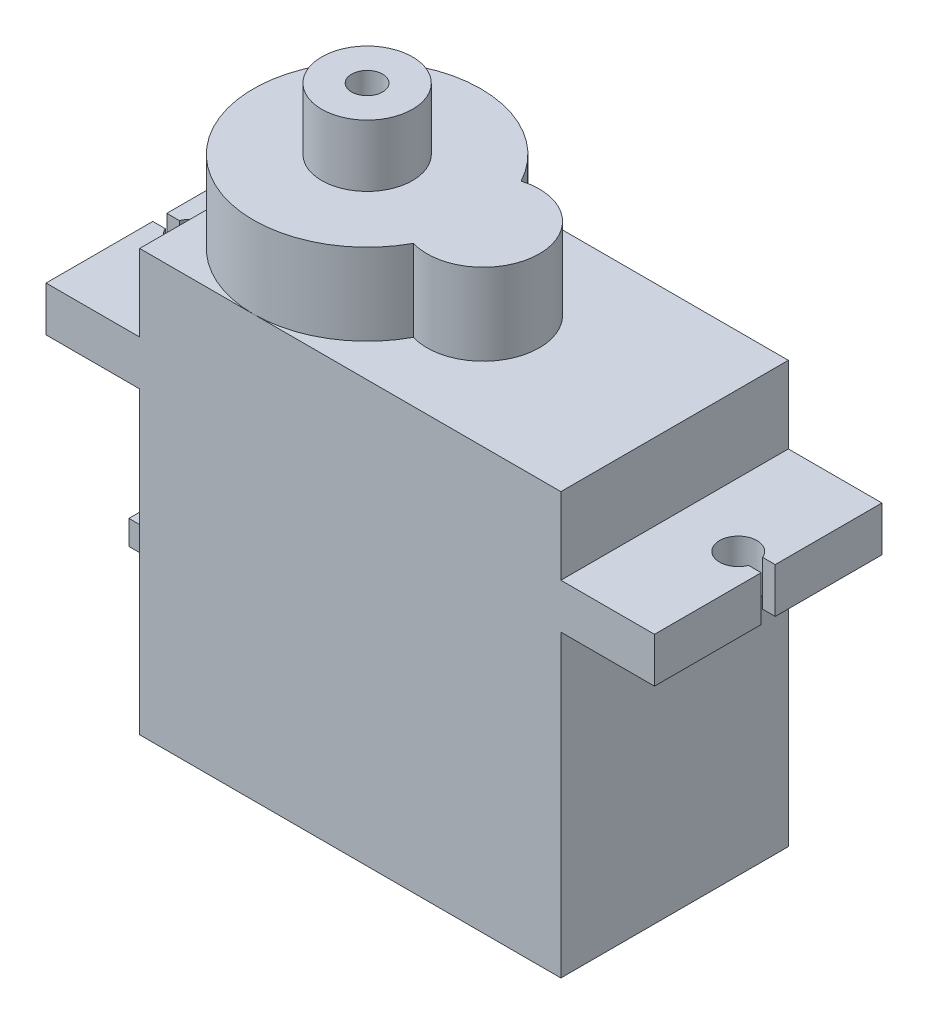
from build123d import *

# Parameters (mm, degrees)
BOSS_EXTRUDE1_DEPTH = 12.15
BOSS_EXTRUDE2_DEPTH = 4.35
SKETCH5_R           = 2.425
BOSS_EXTRUDE3_DEPTH = 3.3
SKETCH6_R           = 0.828221189
CUT_EXTRUDE3_DEPTH  = 4
SKETCH8_R           = 1
CUT_EXTRUDE4_DEPTH  = 5
SKETCH9_W           = 2.165756054
SKETCH9_H           = 0.75
SKETCH9_W_2         = 1.729877666
CUT_EXTRUDE5_DEPTH  = 5
SKETCH10_W          = 3.3
SKETCH10_H          = 1.3
BOSS_EXTRUDE6_DEPTH = 27.5


with BuildPart() as part:
    # Sketch1 → Boss-Extrude1 (new body)
    with BuildSketch(Plane.XY):
        Polygon((-11.25, -11.25), (11.25, -11.25), (11.25, 4.75), (16.25, 4.75), (16.25, 7.15), (11.25, 7.15), (11.25, 11.25), (-11.25, 11.25), (-11.25, 7.15), (-16.25, 7.15), (-16.25, 4.75), (-11.25, 4.75), align=None)
    extrude(amount=BOSS_EXTRUDE1_DEPTH)

    # Sketch4 → Boss-Extrude2 (add)
    with BuildSketch(Plane(origin=(0, 11.25, 0), x_dir=(1, 0, 0), z_dir=(0, 1, 0))):
        with BuildLine():
            ThreePointArc((0.175453629, -3.197801543), (-11.25, -6.075), (0.175453629, -8.952198457))
            ThreePointArc((0.175453629, -8.952198457), (4.025, -6.075), (0.175453629, -3.197801543))
        make_face()
    extrude(amount=BOSS_EXTRUDE2_DEPTH)

    # Sketch5 → Boss-Extrude3 (add)
    with BuildSketch(Plane(origin=(0, 15.6, 0), x_dir=(1, 0, 0), z_dir=(0, 1, 0))):
        with Locations(Location((-5.175, -6.075, 0), (0, 0, 270))):
            Circle(SKETCH5_R)
    extrude(amount=BOSS_EXTRUDE3_DEPTH)

    # Sketch6 → Cut-Extrude3 (cut)
    with BuildSketch(Plane(origin=(0, 18.9, 0), x_dir=(1, 0, 0), z_dir=(0, 1, 0))):
        with Locations(Location((-5.175, -6.075, 0), (0, 0, 270))):
            Circle(SKETCH6_R)
    extrude(amount=-CUT_EXTRUDE3_DEPTH, mode=Mode.SUBTRACT)

    # Sketch8 → Cut-Extrude4 (cut)
    with BuildSketch(Plane(origin=(0, 7.15, 0), x_dir=(1, 0, 0), z_dir=(0, 1, 0))):
        with Locations(Location((-14.65, -6.075, 0), (0, 0, 180))):
            Circle(SKETCH8_R)
        with Locations(Location((14.65, -6.075, 0), (0, 0, 180))):
            Circle(SKETCH8_R)
    extrude(amount=-CUT_EXTRUDE4_DEPTH, mode=Mode.SUBTRACT)

    # Sketch9 → Cut-Extrude5 (cut)
    with BuildSketch(Plane(origin=(0, 7.15, 0), x_dir=(1, 0, 0), z_dir=(0, 1, 0))):
        with Locations((-16.153079265, -6.075)):
            Rectangle(SKETCH9_W, SKETCH9_H)
        with Locations((16.036741918, -6.075)):
            Rectangle(SKETCH9_W_2, SKETCH9_H)
    extrude(amount=-CUT_EXTRUDE5_DEPTH, mode=Mode.SUBTRACT)

    # Sketch10 → Boss-Extrude6 (add)
    with BuildSketch(Plane(origin=(11.25, 0, 0), x_dir=(0, 0, -1), z_dir=(1, 0, 0))):
        with Locations((-6.075, -6.6)):
            Rectangle(SKETCH10_W, SKETCH10_H)
    extrude(amount=-BOSS_EXTRUDE6_DEPTH)


solid = part.part
